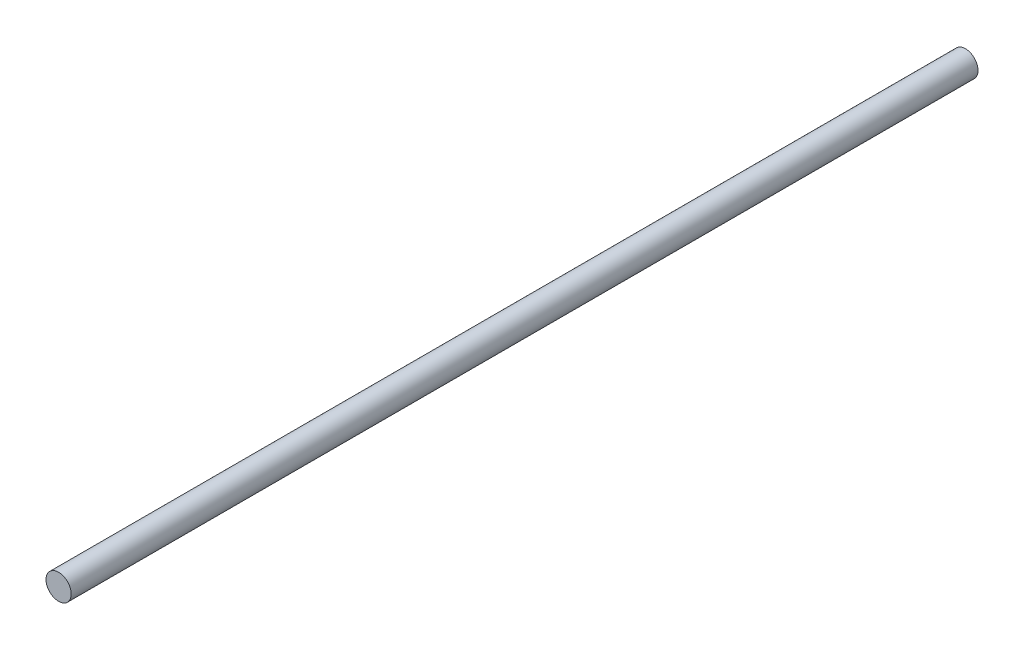
from build123d import *

# Parameters (mm, degrees)
SKETCH1_R           = 5
BOSS_EXTRUDE1_DEPTH = 360


with BuildPart() as part:
    # Sketch1 → Boss-Extrude1 (new body)
    with BuildSketch(Plane.XY):
        with Locations(Location((0, 0, 0), (0, 0, 180))):
            Circle(SKETCH1_R)
    extrude(amount=BOSS_EXTRUDE1_DEPTH)


solid = part.part
